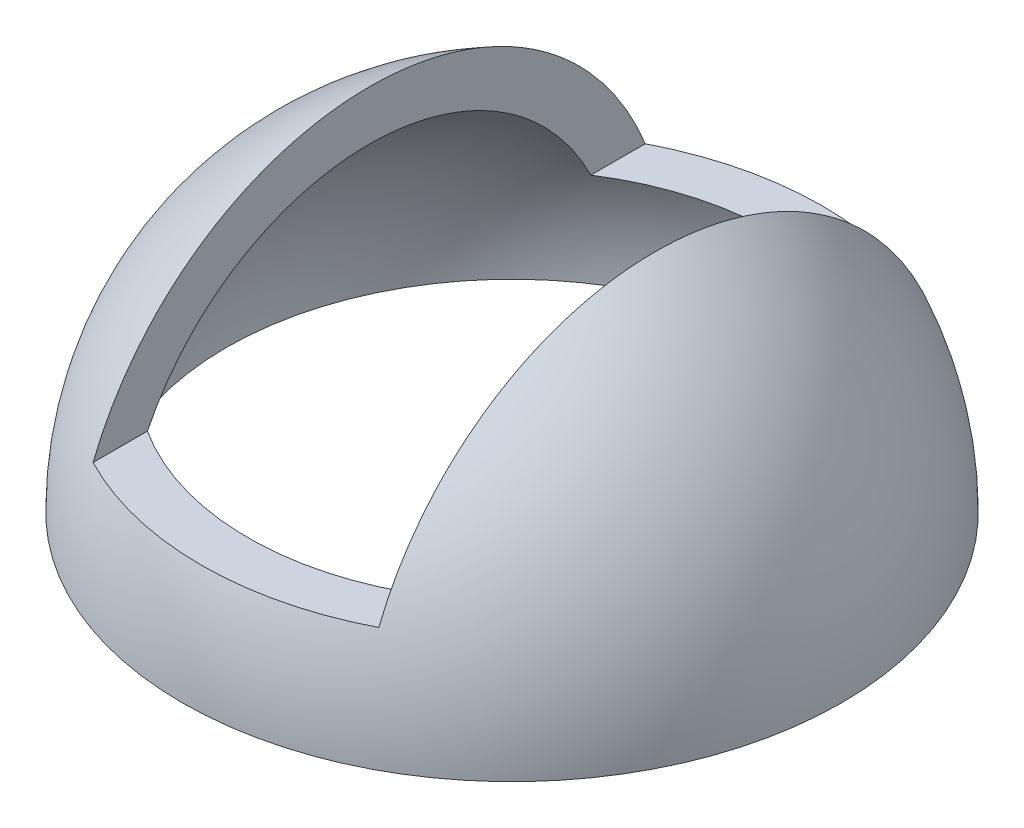
from build123d import *

# Parameters (mm, degrees)
SKETCH2_W          = 16.51
SKETCH2_H          = 16.418842622
CUT_EXTRUDE1_DEPTH = 63.5


with BuildPart() as part:
    # Sketch1 → Revolve1 (revolve)
    with BuildSketch(Plane.XY, mode=Mode.PRIVATE) as revolve1_sk:
        with BuildLine():
            Line((19.05, 0), (16.51, 0))
            ThreePointArc((16.51, 0), (11.674332957, 11.674332957), (0, 16.51))
            Line((0, 16.51), (0, 19.05))
            ThreePointArc((0, 19.05), (13.470384182, 13.470384182), (19.05, 0))
        make_face()
    revolve(revolve1_sk.sketch.rotate(Axis((0, 19.05, 0), (0, -1, 0)), 180), axis=Axis((0, 19.05, 0), (0, -1, 0)))

    # Sketch2 → Cut-Extrude1 (cut, symmetric)
    with BuildSketch(Plane.XY):
        with Locations((0, 14.559421311)):
            Rectangle(SKETCH2_W, SKETCH2_H)
    extrude(amount=CUT_EXTRUDE1_DEPTH, both=True, mode=Mode.SUBTRACT)


solid = part.part
